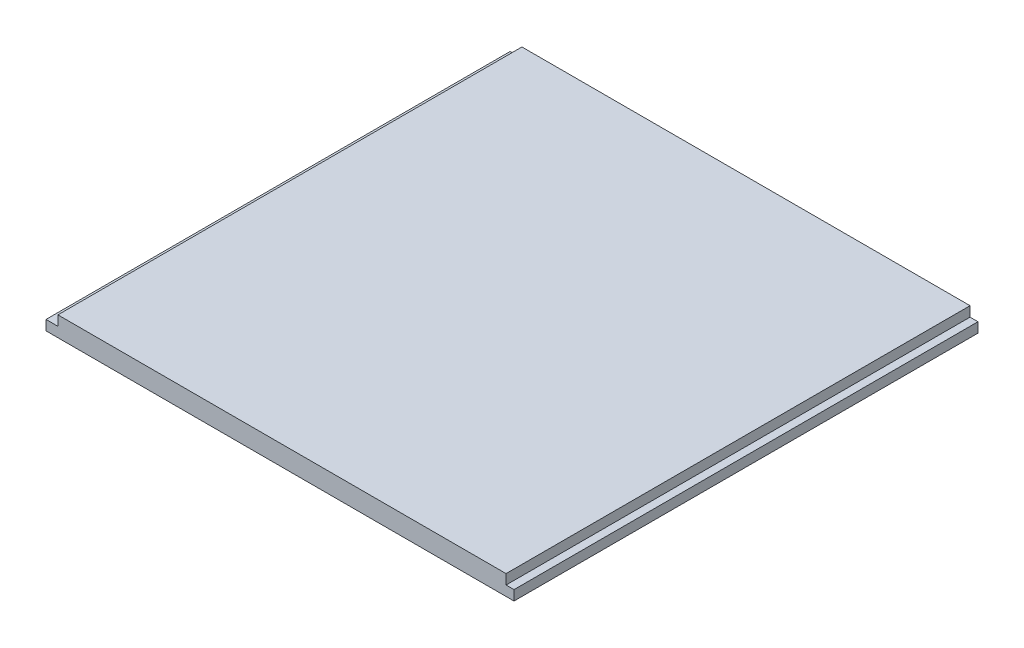
from build123d import *

# Parameters (mm, degrees)
SKETCH_1_W      = 118
SKETCH_1_H      = 2.5
SKETCH_1_W_2    = 113
EXTRUDE_1_DEPTH = 117


with BuildPart() as part:
    # 草图1 → 凸台-拉伸1 (new body)
    with BuildSketch(Plane.XY):
        with Locations((21.996774194, -28.691935484)):
            Rectangle(SKETCH_1_W, SKETCH_1_H)
        with Locations((22.496774194, -26.191935484)):
            Rectangle(SKETCH_1_W_2, SKETCH_1_H)
    extrude(amount=EXTRUDE_1_DEPTH)


solid = part.part
